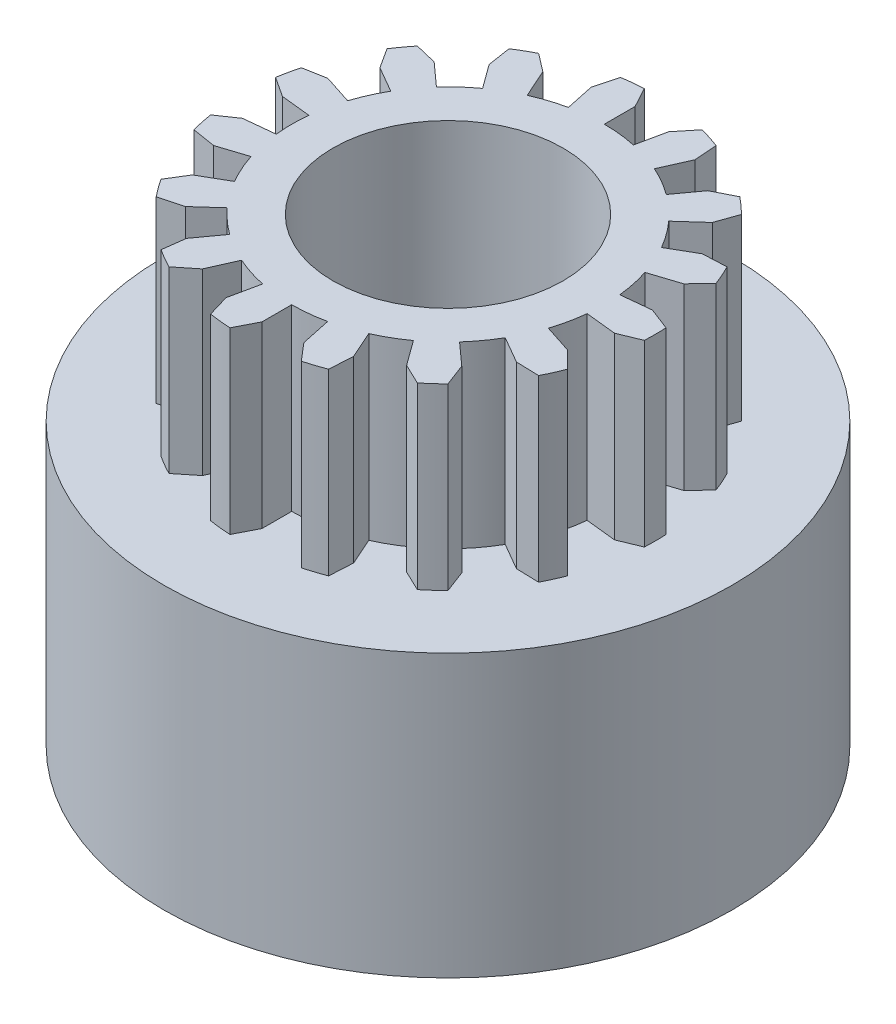
from build123d import *

# Parameters (mm, degrees)
SKETCH1_R           = 11.1125
BOSS_EXTRUDE1_DEPTH = 18
CUT_EXTRUDE2_START  = -7
CUT_EXTRUDE2_DEPTH  = 7
CIRPATTERN1_COUNT   = 15
SKETCH3_R           = 6.5
CUT_EXTRUDE3_DEPTH  = 3
SKETCH4_R           = 4.5
CUT_EXTRUDE4_DEPTH  = 22.724992808


with BuildPart() as part:
    # Sketch1 → Boss-Extrude1 (new body)
    with BuildSketch(Plane(origin=(0, 0, 0), x_dir=(1, 0, 0), z_dir=(0, 1, 0))):
        with Locations(Location((0, 0, 0), (0, 0, 270))):
            Circle(SKETCH1_R)
    extrude(amount=BOSS_EXTRUDE1_DEPTH)

    # Sketch2 → Cut-Extrude2 (cut)
    with BuildSketch(Plane(origin=(0, 18, 0), x_dir=(1, 0, 0), z_dir=(0, 1, 0)).offset(CUT_EXTRUDE2_START)):
        with BuildLine():
            Line((10.151773898, 4.519860946), (7.411137525, 3.299651017))
            ThreePointArc((7.411137525, 3.299651017), (7.494972707, 3.104519345), (7.57367121, 2.907259991))
            Line((7.57367121, 2.907259991), (6.959086209, 2.261144177))
            Line((6.959086209, 2.261144177), (5.813332956, 1.888866378))
            ThreePointArc((5.813332956, 1.888866378), (5.978927209, 1.27086021), (6.079015085, 0.638930232))
            Line((6.079015085, 0.638930232), (7.234212217, 0.760346343))
            Line((7.234212217, 0.760346343), (8.101382101, 0.424575445))
            ThreePointArc((8.101382101, 0.424575445), (8.109720049, 0.212360493), (8.1125, 0))
            Line((8.1125, 0), (11.1125, 0))
            ThreePointArc((11.1125, 0), (10.869665213, 2.310418664), (10.151773898, 4.519860946))
        make_face()
    cut_extrude2 = extrude(amount=CUT_EXTRUDE2_DEPTH, mode=Mode.SUBTRACT)

    # CirPattern1: Cut-Extrude2 ×15 about axis
    cirpattern1_axis = Axis((0, 0, 0), (0, 1, 0))
    for i in range(1, CIRPATTERN1_COUNT):
        add(cut_extrude2.rotate(cirpattern1_axis, i * 360 / CIRPATTERN1_COUNT), mode=Mode.SUBTRACT)

    # Sketch3 → Cut-Extrude3 (cut)
    with BuildSketch(Plane.XZ):
        with Locations(Location((0, 0, 0), (0, 0, 270))):
            Circle(SKETCH3_R)
    extrude(amount=-CUT_EXTRUDE3_DEPTH, mode=Mode.SUBTRACT)

    # Sketch4 → Cut-Extrude4 (cut, through all)
    with BuildSketch(Plane.XZ.offset(-3)):
        with Locations(Location((0, 0, 0), (0, 0, 270))):
            Circle(SKETCH4_R)
    extrude(amount=-CUT_EXTRUDE4_DEPTH, mode=Mode.SUBTRACT)


solid = part.part
